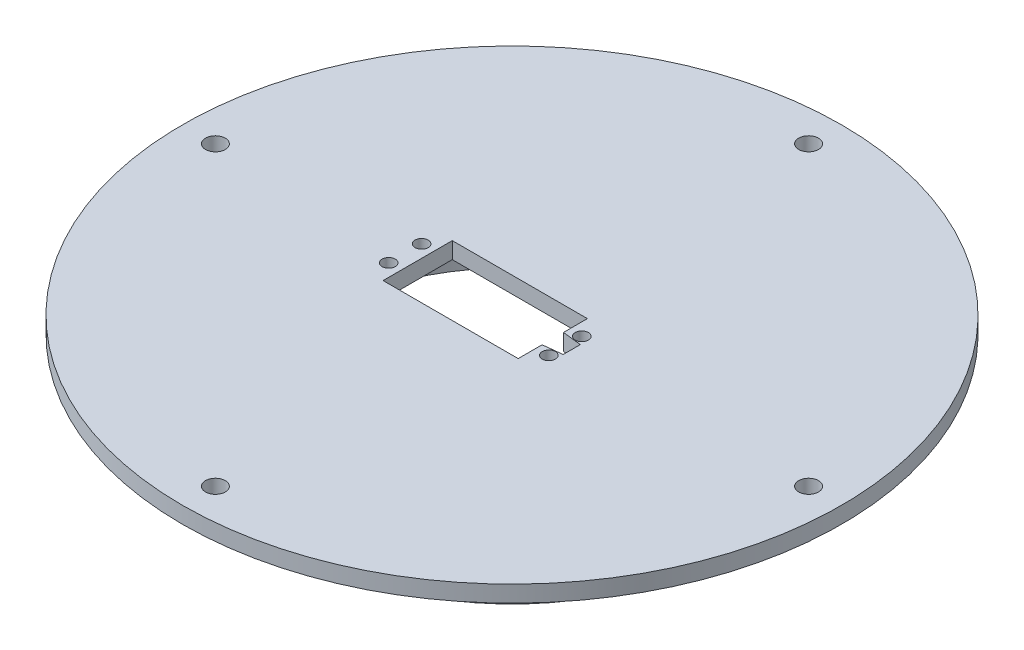
from build123d import *

# Parameters (mm, degrees)
SKETCH_1_R          = 100
EXTRUDE_1_DEPTH     = 5
SKETCH_3_R          = 3
CUT_EXTRUDE_1_DEPTH = 142.509716981
SKETCH_2_R          = 2
SKETCH_2_W          = 41
SKETCH_2_H          = 21
CUT_EXTRUDE_3_DEPTH = 10
SKETCH_4_R          = 65
SKETCH_4_R_2        = 60
EXTRUDE_2_DEPTH     = 25
CUT_EXTRUDE_4_DEPTH = 145.568322948
SKETCH_6_W          = 10
SKETCH_6_H          = 6
CUT_EXTRUDE_5_DEPTH = 165.829829674


with BuildPart() as part:
    # 草图1 → 凸台-拉伸1 (new body)
    with BuildSketch(Plane(origin=(0, 0, 0), x_dir=(1, 0, 0), z_dir=(0, 1, 0))):
        with Locations(Location((0, 0, 0), (0, 0, 270))):
            Circle(SKETCH_1_R)
    extrude(amount=EXTRUDE_1_DEPTH)

    # 草图3 → 切除-拉伸1 (cut, through all)
    with BuildSketch(Plane.XZ):
        with Locations(Location((0, 90, 0), (0, 0, 270))):
            Circle(SKETCH_3_R)
        with Locations(Location((90, 0, 0), (0, 0, 270))):
            Circle(SKETCH_3_R)
        with Locations(Location((0, -90, 0), (0, 0, 270))):
            Circle(SKETCH_3_R)
        with Locations(Location((-90, 0, 0), (0, 0, 270))):
            Circle(SKETCH_3_R)
    extrude(amount=-CUT_EXTRUDE_1_DEPTH, mode=Mode.SUBTRACT)

    # 草图2 → 切除-拉伸3 (cut)
    with BuildSketch(Plane(origin=(0, 0, 0), x_dir=(1, 0, 0), z_dir=(0, 1, 0))):
        with Locations(Location((16.177013134, 5, 0), (0, 0, 270))):
            Circle(SKETCH_2_R)
        with Locations(Location((16.177013134, -5, 0), (0, 0, 90))):
            Circle(SKETCH_2_R)
        with Locations(Location((-32.422986866, -5, 0), (0, 0, 270))):
            Circle(SKETCH_2_R)
        with Locations(Location((-32.422986866, 5, 0), (0, 0, 90))):
            Circle(SKETCH_2_R)
        with Locations((-8.122986866, 0)):
            Rectangle(SKETCH_2_W, SKETCH_2_H)
    extrude(amount=CUT_EXTRUDE_3_DEPTH, mode=Mode.SUBTRACT)

    # 草图4 → 凸台-拉伸2 (add)
    with BuildSketch(Plane.XZ):
        with Locations(Location((0, 0, 0), (0, 0, 270))):
            Circle(SKETCH_4_R)
        with Locations(Location((0, 0, 0), (0, 0, 270))):
            Circle(SKETCH_4_R_2, mode=Mode.SUBTRACT)
    extrude(amount=EXTRUDE_2_DEPTH)

    # 草图5 → 切除-拉伸4 (cut, through all)
    with BuildSketch(Plane(origin=(0, 5, 0), x_dir=(1, 0, 0), z_dir=(0, 1, 0))):
        Polygon((12.377013134, 3.25), (12.377013134, 0), (18.12919557, 0), (18.12919557, 2.6), align=None)
        Polygon((12.377013134, 0), (12.377013134, -3.25), (18.12919557, -2.6), (18.12919557, 0), align=None)
    extrude(amount=-CUT_EXTRUDE_4_DEPTH, mode=Mode.SUBTRACT)

    # 草图6 → 切除-拉伸5 (cut, through all)
    with BuildSketch(Plane(origin=(-28.622986866, 0, 0), x_dir=(0, 0, -1), z_dir=(1, 0, 0))):
        with Locations((0, -22)):
            Rectangle(SKETCH_6_W, SKETCH_6_H)
    extrude(amount=CUT_EXTRUDE_5_DEPTH, mode=Mode.SUBTRACT)


solid = part.part
